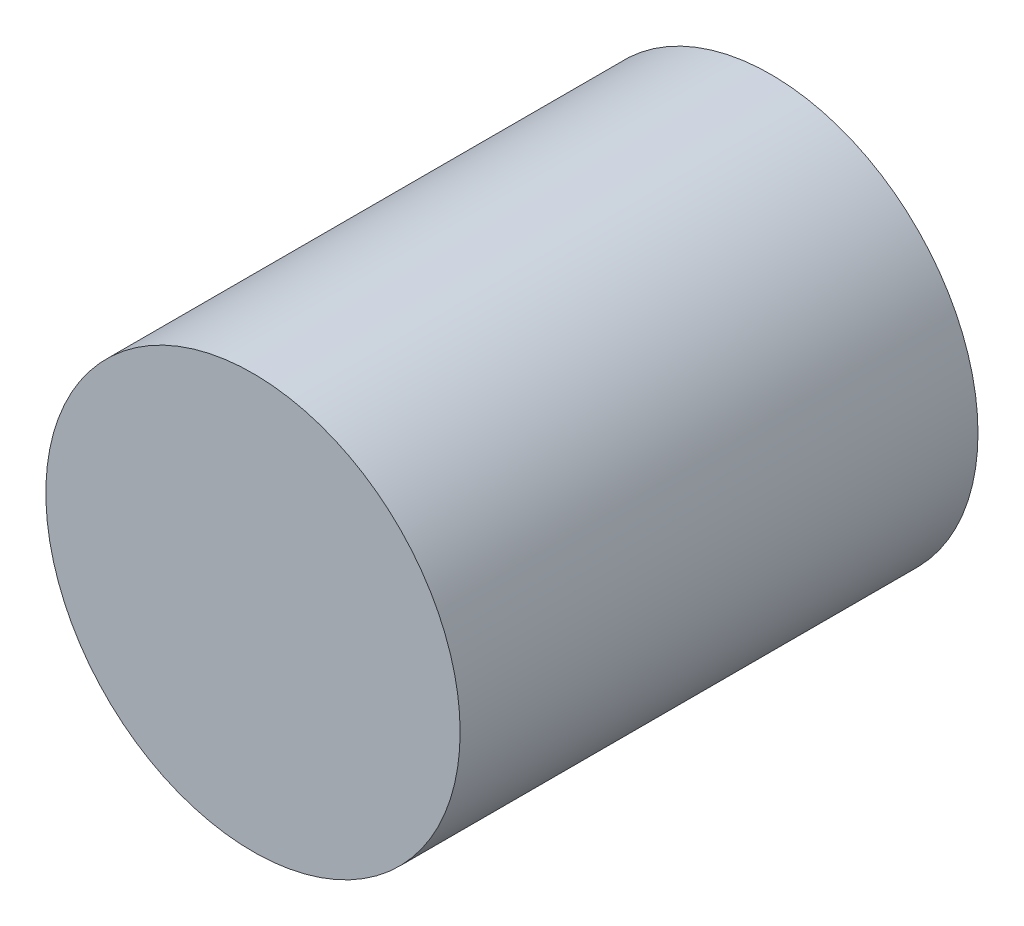
from build123d import *

# Parameters (mm, degrees)
ESBO_O1_R                = 10
RESSALTO_EXTRUS_O1_DEPTH = 25


with BuildPart() as part:
    # Esboço1 → Ressalto-extrusão1 (new body)
    with BuildSketch(Plane.XY):
        Circle(ESBO_O1_R)
    extrude(amount=RESSALTO_EXTRUS_O1_DEPTH)


solid = part.part
